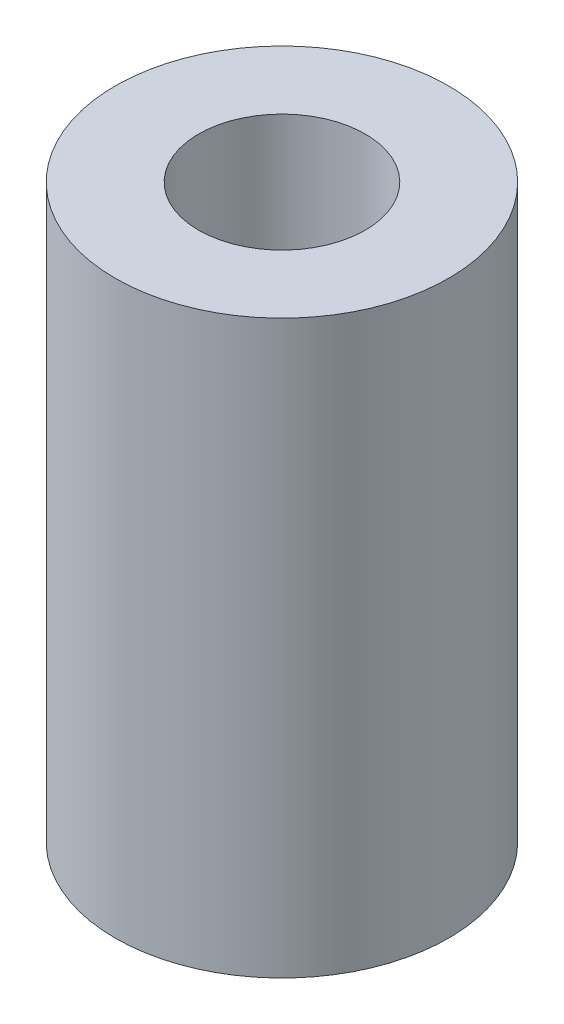
from build123d import *

# Parameters (mm, degrees)
SKETCH1_R           = 3.5
SKETCH1_R_2         = 1.75
BOSS_EXTRUDE1_DEPTH = 12


with BuildPart() as part:
    # Sketch1 → Boss-Extrude1 (new body)
    with BuildSketch(Plane(origin=(0, 0, 0), x_dir=(1, 0, 0), z_dir=(0, 1, 0))):
        with Locations(Location((0, 0, 0), (0, 0, 270))):
            Circle(SKETCH1_R)
        with Locations(Location((0, 0, 0), (0, 0, 270))):
            Circle(SKETCH1_R_2, mode=Mode.SUBTRACT)
    extrude(amount=BOSS_EXTRUDE1_DEPTH)


solid = part.part
